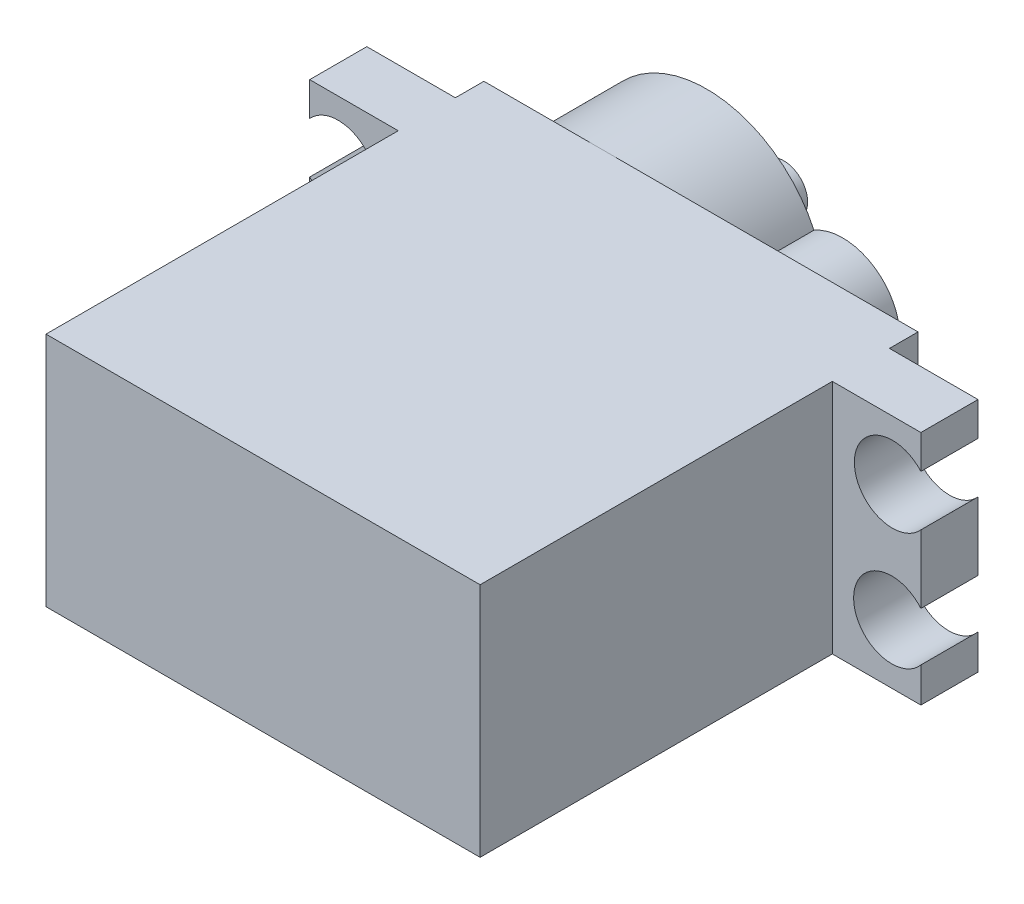
from build123d import *

# Parameters (mm, degrees)
SKETCH1_W             = 11.4
SKETCH1_H             = 12.4
BOSS_EXTRUDE1_DEPTH   = 18.5
SKETCH1_4_W           = 4.65
SKETCH1_4_H           = 12.4
BOSS_EXTRUDE2_DEPTH   = 2.5
BOSS_EXTRUDE2_2_DEPTH = 2.5
SKETCH1_11_W          = 4.65
SKETCH1_11_H          = 12.4
BOSS_EXTRUDE8_DEPTH   = 3
SKETCH1_13_W          = 11.4
SKETCH1_13_H          = 12.4
BOSS_EXTRUDE9_DEPTH   = 4.5
BOSS_EXTRUDE11_DEPTH  = 5.5
SKETCH10_R            = 1.25
BOSS_EXTRUDE12_DEPTH  = 4
BOSS_EXTRUDE13_DEPTH  = 5
SKETCH15_R            = 2
CUT_EXTRUDE1_DEPTH    = 3


with BuildPart() as part:
    # Sketch1 → Boss-Extrude1 (new body)
    with BuildSketch(Plane.XY):
        with Locations((10.35, 6.2)):
            Rectangle(SKETCH1_W, SKETCH1_H)
        with Locations((21.75, 6.2)):
            Rectangle(SKETCH1_W, SKETCH1_H)
    extrude(amount=BOSS_EXTRUDE1_DEPTH)



with BuildPart() as body_2:
    # Sketch1<4> → Boss-Extrude2 (new body)
    with BuildSketch(Plane.XY):
        with Locations((2.325, 6.2)):
            Rectangle(SKETCH1_4_W, SKETCH1_4_H)
    extrude(amount=-BOSS_EXTRUDE2_DEPTH)



with BuildPart() as body_3:
    # Sketch1<4> → Boss-Extrude2 2 (new body)
    with BuildSketch(Plane.XY):
        with Locations((29.775, 6.2)):
            Rectangle(SKETCH1_4_W, SKETCH1_4_H)
    extrude(amount=-BOSS_EXTRUDE2_2_DEPTH)


with BuildPart() as body_2_1:
    add(body_2.part)

    add(body_3.part)  # Boss-Extrude8 merges body 3
    # Sketch1<11> → Boss-Extrude8 (add)
    with BuildSketch(Plane.XY):
        with Locations((29.775, 6.2)):
            Rectangle(SKETCH1_11_W, SKETCH1_11_H)
        with Locations((2.325, 6.2)):
            Rectangle(SKETCH1_11_W, SKETCH1_11_H)
    extrude(amount=-BOSS_EXTRUDE8_DEPTH)


with BuildPart() as part_1:
    add(part.part)

    add(body_2_1.part)  # Boss-Extrude9 merges body 2
    # Sketch1<13> → Boss-Extrude9 (add)
    with BuildSketch(Plane.XY):
        with Locations((21.75, 6.2)):
            Rectangle(SKETCH1_13_W, SKETCH1_13_H)
        with Locations((10.35, 6.2)):
            Rectangle(SKETCH1_13_W, SKETCH1_13_H)
    extrude(amount=-BOSS_EXTRUDE9_DEPTH)

    # Sketch8 → Boss-Extrude11 (add)
    with BuildSketch(Plane(origin=(0, 0, -4.5), x_dir=(-1, 0, 0), z_dir=(0, 0, -1))):
        with BuildLine():
            ThreePointArc((-16.482252321, 3.608140862), (-4.65, 6.2), (-16.482252321, 8.791859138))
            ThreePointArc((-16.482252321, 8.791859138), (-20.992969439, 6.2), (-16.482252321, 3.608140862))
        make_face()
    extrude(amount=BOSS_EXTRUDE11_DEPTH)

    # Sketch10 → Boss-Extrude12 (add)
    with BuildSketch(Plane(origin=(0, 0, -10), x_dir=(-1, 0, 0), z_dir=(0, 0, -1))):
        with Locations((-10.902835345, 5.910258943)):
            Circle(SKETCH10_R)
    extrude(amount=BOSS_EXTRUDE12_DEPTH)

    # Sketch8<2> → Boss-Extrude13 (add)
    with BuildSketch(Plane(origin=(0, 0, -4.5), x_dir=(-1, 0, 0), z_dir=(0, 0, -1))):
        with BuildLine():
            ThreePointArc((-16.482252321, 3.608140862), (-4.65, 6.2), (-16.482252321, 8.791859138))
            ThreePointArc((-16.482252321, 8.791859138), (-20.992969439, 6.2), (-16.482252321, 3.608140862))
        make_face()
    extrude(amount=BOSS_EXTRUDE13_DEPTH)

    # Sketch15 → Cut-Extrude1 (cut)
    with BuildSketch(Plane(origin=(0, 0, -3), x_dir=(-1, 0, 0), z_dir=(0, 0, -1))):
        with BuildLine():
            ThreePointArc((-32.1, 10.629307241), (-32.605696731, 9.3), (-32.1, 7.970692759))
            Line((-32.1, 7.970692759), (-32.1, 10.629307241))
        make_face()
        with BuildLine():
            Line((-32.1, 10.629307241), (-32.1, 7.970692759))
            ThreePointArc((-32.1, 7.970692759), (-29.894573162, 7.430694442), (-28.605696731, 9.3))
            ThreePointArc((-28.605696731, 9.3), (-29.894573162, 11.169305558), (-32.1, 10.629307241))
        make_face()
        with Locations((-1.494303269, 9.3)):
            Circle(SKETCH15_R)
        with BuildLine():
            ThreePointArc((0, 4.429307241), (-3.494303269, 3.1), (0, 1.770692759))
            Line((0, 1.770692759), (0, 4.429307241))
        make_face()
        with BuildLine():
            Line((0, 4.429307241), (0, 1.770692759))
            ThreePointArc((0, 1.770692759), (0.375002289, 2.38887643), (0.505696731, 3.1))
            ThreePointArc((0.505696731, 3.1), (0.375002289, 3.81112357), (0, 4.429307241))
        make_face()
        with Locations((-30.567157508, 3.111527569)):
            Circle(SKETCH15_R)
    extrude(amount=-CUT_EXTRUDE1_DEPTH, mode=Mode.SUBTRACT)


solid = part_1.part
